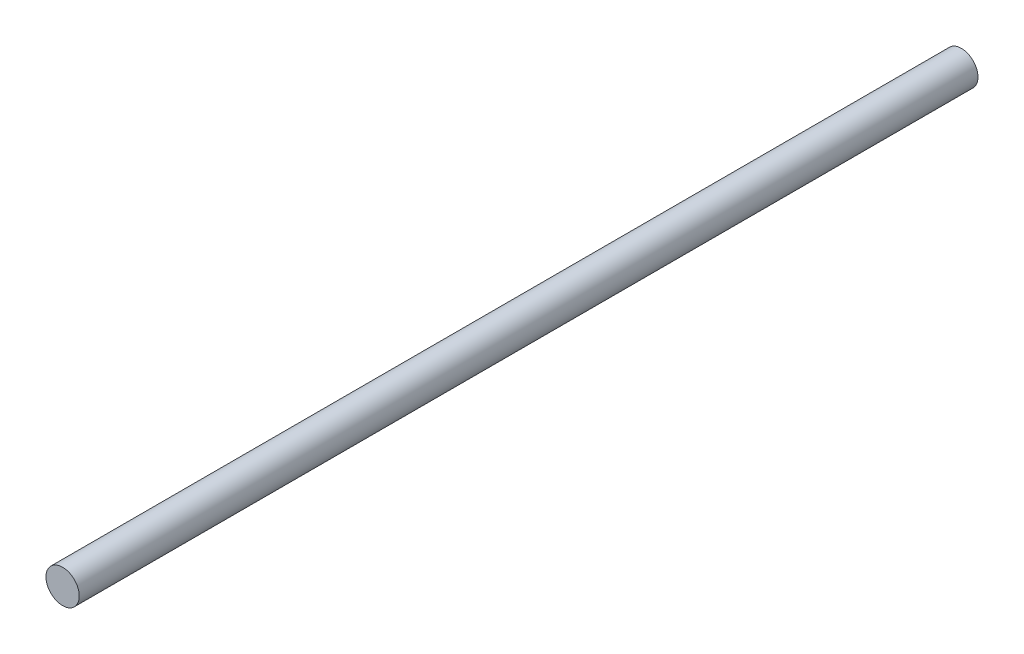
from build123d import *

# Parameters (mm, degrees)
SKETCH1_R           = 3
BOSS_EXTRUDE1_DEPTH = 162


with BuildPart() as part:
    # Sketch1 → Boss-Extrude1 (new body)
    with BuildSketch(Plane.XY):
        Circle(SKETCH1_R)
    extrude(amount=BOSS_EXTRUDE1_DEPTH)


solid = part.part
